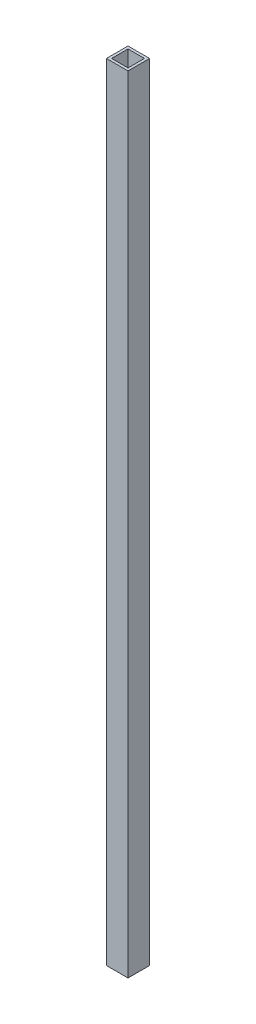
from build123d import *

# Parameters (mm, degrees)
SKETCH1_W           = 8.5
SKETCH1_H           = 8.5
SKETCH1_W_2         = 6.5
SKETCH1_H_2         = 6.5
BOSS_EXTRUDE1_DEPTH = 310


with BuildPart() as part:
    # Sketch1 → Boss-Extrude1 (new body)
    with BuildSketch(Plane(origin=(0, 0, 0), x_dir=(1, 0, 0), z_dir=(0, 1, 0))):
        with Locations((20.126704545, 26.085227273)):
            Rectangle(SKETCH1_W, SKETCH1_H)
        with Locations((20.126704545, 26.085227273)):
            Rectangle(SKETCH1_W_2, SKETCH1_H_2, mode=Mode.SUBTRACT)
    extrude(amount=BOSS_EXTRUDE1_DEPTH)


solid = part.part
